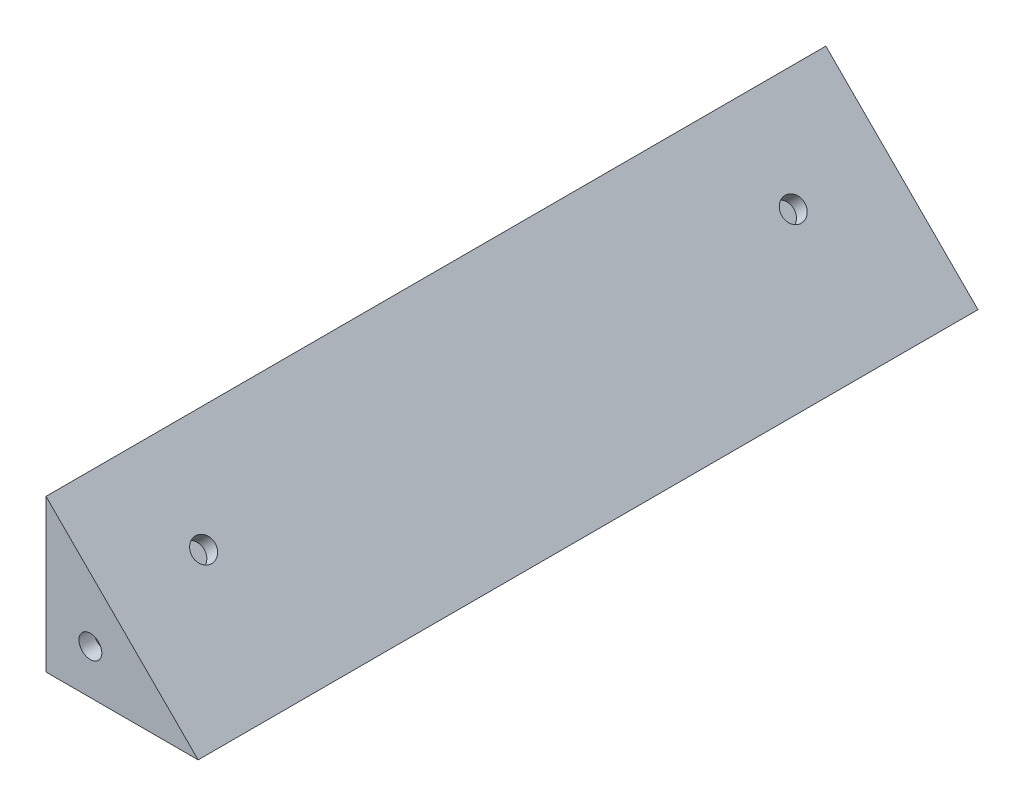
from build123d import *

# Parameters (mm, degrees)
BOSS_EXTRUDE1_DEPTH = 61.5
CUT_EXTRUDE1_DEPTH  = 3.2
SKETCH1_5_R         = 0.9
BOSS_EXTRUDE2_DEPTH = 1.2
CUT_EXTRUDE2_DEPTH  = 3.2
BOSS_EXTRUDE3_START = -1.2
SKETCH2_4_R         = 0.9
BOSS_EXTRUDE3_DEPTH = 1.2
CUT_EXTRUDE3_DEPTH  = 3.2
SKETCH4_3_R         = 0.9
BOSS_EXTRUDE4_DEPTH = 1.2
CUT_EXTRUDE4_DEPTH  = 64.798510954


with BuildPart() as part:
    # Sketch1 → Boss-Extrude1 (new body)
    with BuildSketch(Plane.XY):
        Polygon((12, 0), (0, 12), (0, 0), align=None)
    extrude(amount=BOSS_EXTRUDE1_DEPTH)

    # Sketch1<4> → Cut-Extrude1 (cut)
    with BuildSketch(Plane.XY):
        Polygon((10.535533906, 0), (4.247146227, 6.288387679), (1.458758548, 5.541241452), (0.711612321, 2.752853773), (3.464466094, 0), align=None)
    extrude(amount=CUT_EXTRUDE1_DEPTH, mode=Mode.SUBTRACT)

    # Sketch1<5> → Boss-Extrude2 (add)
    with BuildSketch(Plane.XY):
        Polygon((10.535533906, 0), (4.247146227, 6.288387679), (1.458758548, 5.541241452), (0.711612321, 2.752853773), (3.464466094, 0), align=None)
        with Locations((3.5, 3.5)):
            Circle(SKETCH1_5_R, mode=Mode.SUBTRACT)
    extrude(amount=BOSS_EXTRUDE2_DEPTH)

    # Sketch2 → Cut-Extrude2 (cut)
    with BuildSketch(Plane.XY.offset(61.5)):
        Polygon((0.711612321, 2.752853773), (3.464466094, 0), (10.535533906, 0), (4.247146227, 6.288387679), (1.458758548, 5.541241452), align=None)
    extrude(amount=-CUT_EXTRUDE2_DEPTH, mode=Mode.SUBTRACT)

    # Sketch2<4> → Boss-Extrude3 (add)
    with BuildSketch(Plane.XY.offset(61.5).offset(BOSS_EXTRUDE3_START)):
        Polygon((0.711612321, 2.752853773), (3.464466094, 0), (10.535533906, 0), (4.247146227, 6.288387679), (1.458758548, 5.541241452), align=None)
        with Locations((3.5, 3.5)):
            Circle(SKETCH2_4_R, mode=Mode.SUBTRACT)
    extrude(amount=BOSS_EXTRUDE3_DEPTH)

    # Sketch4 → Cut-Extrude3 (cut)
    with BuildSketch(Plane(origin=(6, 6, 0), x_dir=(0, 0, -1), z_dir=(0.7071067811865477, 0.7071067811865475, 0))):
        Polygon((-51.5, -8.485281374), (-51.5, 2.958094299), (-54, 4.401469972), (-56.5, 2.958094299), (-56.5, -8.485281374), align=None)
        Polygon((-5, -8.485281374), (-5, 2.958094299), (-7.5, 4.401469972), (-10, 2.958094299), (-10, -8.485281374), align=None)
    extrude(amount=-CUT_EXTRUDE3_DEPTH, mode=Mode.SUBTRACT)

    # Sketch4<3> → Boss-Extrude4 (add)
    # profile 1 of 2: a face of its own
    with BuildSketch(Plane(origin=(6, 6, 0), x_dir=(0, 0, -1), z_dir=(0.7071067811865477, 0.7071067811865475, 0))):
        Polygon((-51.5, -8.485281374), (-51.5, 2.958094299), (-54, 4.401469972), (-56.5, 2.958094299), (-56.5, -8.485281374), align=None)
        with Locations((-54, 1.514718626)):
            Circle(SKETCH4_3_R, mode=Mode.SUBTRACT)
    # profile 2 of 2: a face of its own
    with BuildSketch(Plane(origin=(6, 6, 0), x_dir=(0, 0, -1), z_dir=(0.7071067811865477, 0.7071067811865475, 0))):
        Polygon((-5, -8.485281374), (-5, 2.958094299), (-7.5, 4.401469972), (-10, 2.958094299), (-10, -8.485281374), align=None)
        with Locations((-7.5, 1.514718626)):
            Circle(SKETCH4_3_R, mode=Mode.SUBTRACT)
    extrude(amount=-BOSS_EXTRUDE4_DEPTH)

    # Sketch1<6> → Cut-Extrude4 (cut, through all)
    with BuildSketch(Plane.XY):
        Polygon((12, -2.237434652), (12, 0), (10.535533906, 0), (7, 0), (3.5, 0), (3.464466094, 0), (0, 0), (0, -2.237434652), align=None)
    extrude(amount=CUT_EXTRUDE4_DEPTH, mode=Mode.SUBTRACT)


solid = part.part
